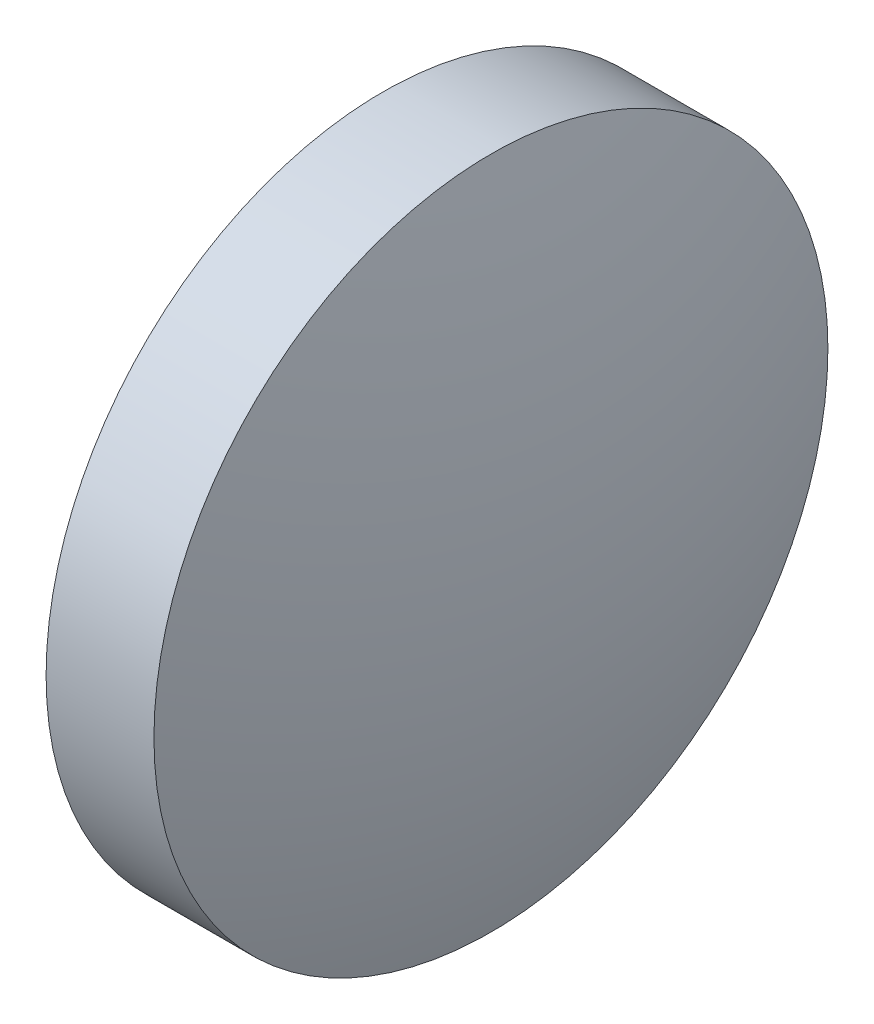
from build123d import *


with BuildPart() as part:
    # Esquisse11 → Révolution3 (revolve)
    with BuildSketch(Plane(origin=(0, 0, 0), x_dir=(1, 0, 0), z_dir=(0, 1, 0))):
        with BuildLine():
            Line((2, -12.5), (-2, -12.5))
            ThreePointArc((-2, -12.5), (-3.499292043, -6.329754523), (-4.003289616, 0))
            Line((-4.003289616, 0), (4.003289616, 0))
            ThreePointArc((4.003289616, 0), (3.499292043, -6.329754523), (2, -12.5))
        make_face()
    revolve(axis=Axis((0, 0, 0), (-1, 0, 0)))


solid = part.part
